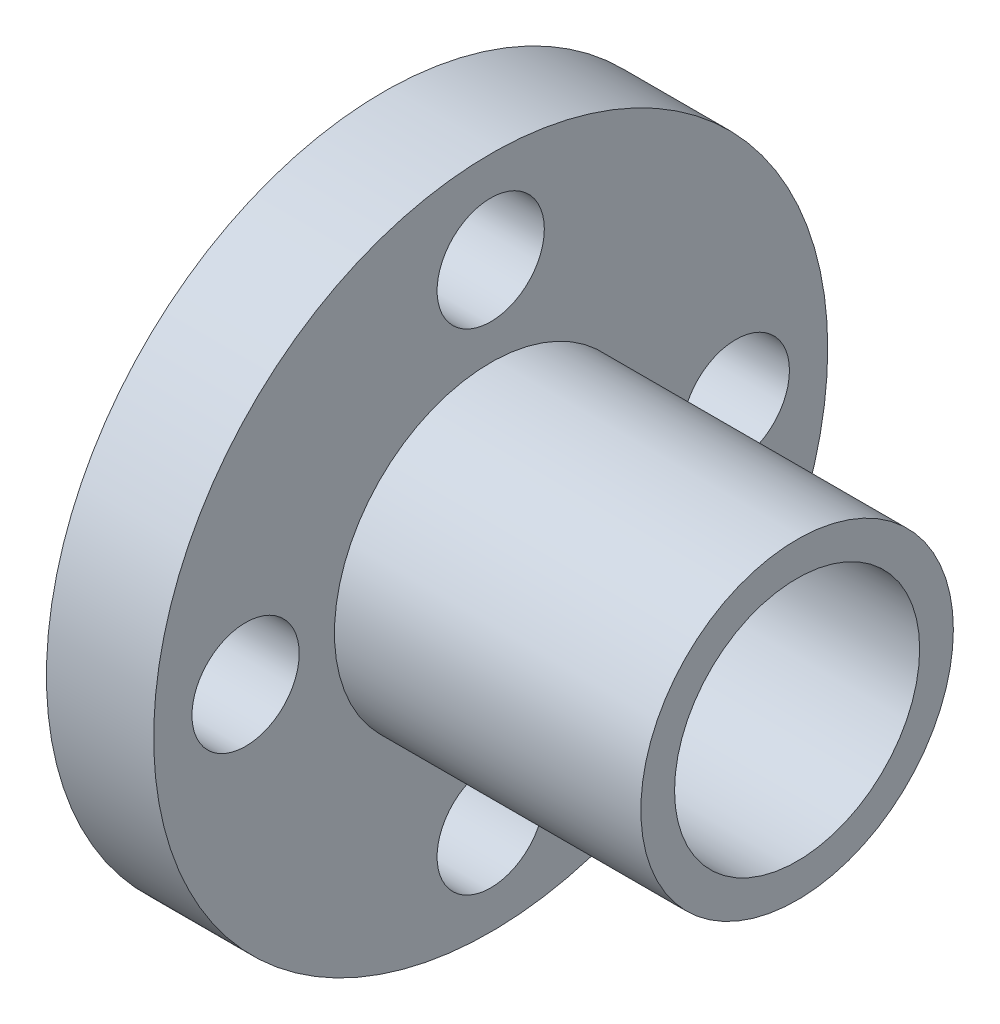
from build123d import *

# Parameters (mm, degrees)
SKETCH_1_R           = 11
SKETCH_1_R_2         = 4
SKETCH_1_R_3         = 1.75
EXTRUDE_1_DEPTH      = 3.5
EXTRUDE_2_DEPTH      = 10
EXTRUDE_2_DEPTH_BACK = 5
SKETCH_2_R           = 5.1
SKETCH_2_R_2         = 4


with BuildPart() as part:
    # 草图1 → 凸台-拉伸1 (new body)
    with BuildSketch(Plane(origin=(0, 0, 0), x_dir=(0, 0, -1), z_dir=(1, 0, 0))):
        Circle(SKETCH_1_R)
        Circle(SKETCH_1_R_2, mode=Mode.SUBTRACT)
        with Locations((0, 8)):
            Circle(SKETCH_1_R_3, mode=Mode.SUBTRACT)
        with Locations((8, 0)):
            Circle(SKETCH_1_R_3, mode=Mode.SUBTRACT)
        with Locations((0, -8)):
            Circle(SKETCH_1_R_3, mode=Mode.SUBTRACT)
        with Locations((-8, 0)):
            Circle(SKETCH_1_R_3, mode=Mode.SUBTRACT)
    extrude(amount=EXTRUDE_1_DEPTH)

    # 草图2 → 凸台-拉伸2 (add, two sides: drawn at the far end of the back side and taken through both)
    with BuildSketch(Plane(origin=(3.5, 0, 0), x_dir=(0, 0, -1), z_dir=(1, 0, 0)).offset(-EXTRUDE_2_DEPTH_BACK)):
        Circle(SKETCH_2_R)
        Circle(SKETCH_2_R_2, mode=Mode.SUBTRACT)
    extrude(amount=EXTRUDE_2_DEPTH + EXTRUDE_2_DEPTH_BACK)


solid = part.part
